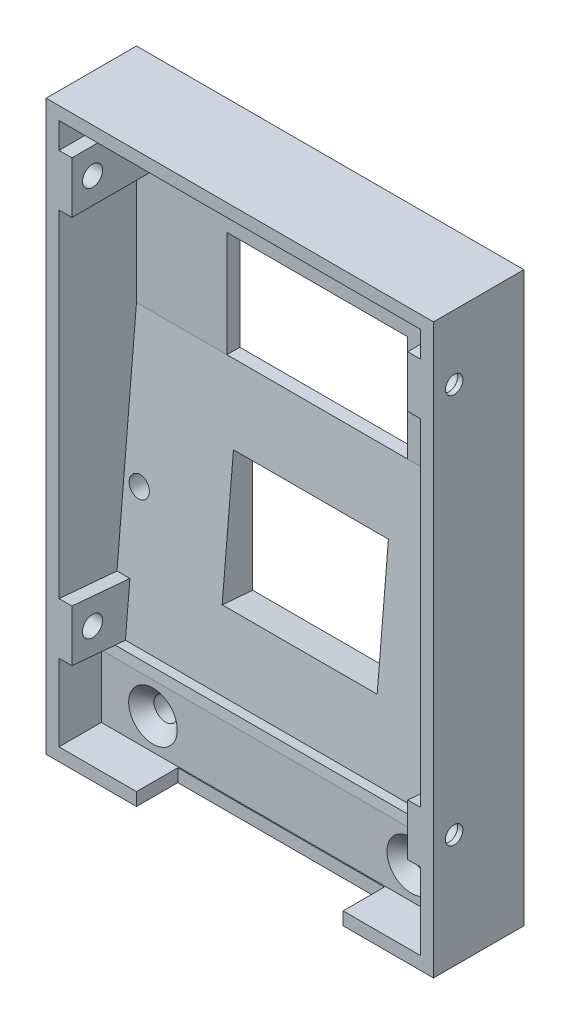
from build123d import *

# Parameters (mm, degrees)
SKICA1_W                                          = 75
SKICA1_H                                          = 110
SKICA1_W_2                                        = 35
SKICA1_H_2                                        = 70
P_IDAT_VYSUNUT_M1_DEPTH                           = 2.5
SKICA2_W                                          = 75
SKICA2_H                                          = 110
SKICA2_W_2                                        = 70
SKICA2_H_2                                        = 105
P_IDAT_VYSUNUT_M2_DEPTH                           = 15
P_IDAT_VYSUNUT_M3_REACH                           = 94.669
SKICA4_W                                          = 35
SKICA4_H                                          = 49.5
P_IDAT_VYSUNUT_M4_DEPTH                           = 2.5
SKICA5_W                                          = 70
SKICA5_H                                          = 2
P_IDAT_VYSUNUT_M5_DEPTH                           = 2
P_IDAT_VYSUNUT_M7_REACH                           = 94.669
KU_ELOV_ZAHLOUBEN_PRO_M4_ROUBU_SE_Z_P_D           = 4.5
KU_ELOV_ZAHLOUBEN_PRO_M4_ROUBU_SE_Z_P_CSINK_D     = 9.4
KU_ELOV_ZAHLOUBEN_PRO_M4_ROUBU_SE_Z_P_CSINK_ANGLE = 90
KU_ELOV_ZAHLOUBEN_PRO_M4_ROUBU_SE_2_A_COUNT       = 2
KU_ELOV_ZAHLOUBEN_PRO_M4_ROUBU_SE_2_A_PITCH       = 50
D_RY_PRO_KOL_K_VELIKOST_MM1_D                     = 3.9
D_RY_PRO_KOL_K_VELIKOST_MM1_DEPTH                 = 4
SKICA19_W                                         = 30
SKICA19_H                                         = 25
ODEBRAT_VYSUNUT_M1_DEPTH                          = 69.239931365
ODEBRAT_VYSUNUT_M4_DEPTH                          = 10
SKICA21_W                                         = 15
SKICA21_H                                         = 10
P_IDAT_VYSUNUT_M8_DEPTH                           = 2.5
V_LCOV_ZAHLOUBEN_PRO_M3_ROUBY_S_VNIT_D            = 3.4
V_LCOV_ZAHLOUBEN_PRO_M3_ROUBY_S_VNIT_DEPTH        = 5
V_LCOV_ZAHLOUBEN_PRO_M3_ROUBY_S_VNIT_CBORE_D      = 3.9
V_LCOV_ZAHLOUBEN_PRO_M3_ROUBY_S_VNIT_CBORE_DEPTH  = 4


with BuildPart() as part:
    # Skica1 → Přidat vysunutím1 (new body)
    with BuildSketch(Plane.XY):
        Rectangle(SKICA1_W, SKICA1_H)
        Rectangle(SKICA1_W_2, SKICA1_H_2, mode=Mode.SUBTRACT)
    extrude(amount=P_IDAT_VYSUNUT_M1_DEPTH)

    # Skica2 → Přidat vysunutím2 (add)
    with BuildSketch(Plane.XY.offset(2.5)):
        Rectangle(SKICA2_W, SKICA2_H)
        Rectangle(SKICA2_W_2, SKICA2_H_2, mode=Mode.SUBTRACT)
    extrude(amount=P_IDAT_VYSUNUT_M2_DEPTH)

    # Skica3 → Přidat vysunutím3 (add, up to next)
    with BuildSketch(Plane.ZY.offset(-35), mode=Mode.PRIVATE) as p_idat_vysunut_m3_sk1:
        Polygon((2.5, -52.5), (2.5, 14.5), (8.361740456, -52.5), align=None)
    p_idat_vysunut_m3_tool1 = extrude(p_idat_vysunut_m3_sk1.sketch, amount=P_IDAT_VYSUNUT_M3_REACH, mode=Mode.PRIVATE) - part.part
    add(p_idat_vysunut_m3_tool1.solids().sort_by_distance((35, -30.166667, 4.453913))[0])

    # Skica4 → Přidat vysunutím4 (add)
    with BuildSketch(Plane(origin=(0, 0, 2.5), x_dir=(-1, 0, 0), z_dir=(0, 0, -1))):
        with Locations((0, -10.25)):
            Rectangle(SKICA4_W, SKICA4_H)
    extrude(amount=P_IDAT_VYSUNUT_M4_DEPTH)

    # Skica5 → Přidat vysunutím5 (add)
    with BuildSketch(Plane(origin=(0, 0.327204013, 3.739958979), x_dir=(1, 0, 0), z_dir=(0, 0.08715574274765159, 0.9961946980917462))):
        with Locations((0, -40.02899535)):
            Rectangle(SKICA5_W, SKICA5_H)
    extrude(amount=P_IDAT_VYSUNUT_M5_DEPTH)

    # Skica9 → Přidat vysunutím7 (add, up to next)
    with BuildSketch(Plane.ZY.offset(-35), mode=Mode.PRIVATE) as p_idat_vysunut_m7_sk1:
        Polygon((9.308260939, -52.5), (9.308260939, -40.371352137), (7.315871543, -40.545663623), (8.361740456, -52.5), align=None)
    p_idat_vysunut_m7_tool1 = extrude(p_idat_vysunut_m7_sk1.sketch, amount=P_IDAT_VYSUNUT_M7_REACH, mode=Mode.PRIVATE) - part.part
    add(p_idat_vysunut_m7_tool1.solids().sort_by_distance((35, -45.761665, 8.543512))[0])

    # Ku_elov_ zahlouben_ pro M4 _roubu se z_p (through all)
    with Locations(Plane.XY.offset(9.308260939)):
        with Locations((25, -46.435676069), (-25, -46.435676069)):
            CounterSinkHole(KU_ELOV_ZAHLOUBEN_PRO_M4_ROUBU_SE_Z_P_D / 2, KU_ELOV_ZAHLOUBEN_PRO_M4_ROUBU_SE_Z_P_CSINK_D / 2, counter_sink_angle=KU_ELOV_ZAHLOUBEN_PRO_M4_ROUBU_SE_Z_P_CSINK_ANGLE)

    # Skica15 → Ku_elov_ zahlouben_ pro M4 _roubu se 2 (revolve, cut)
    with BuildSketch(Plane(origin=(25, 42.5, 2.5), x_dir=(0, -1, 0), z_dir=(1, 0, 0))):
        Polygon((0, 0), (0, 2.5), (2.25, 2.5), (2.25, 2.45), (4.7, 0), align=None)
    ku_elov_zahlouben_pro_m4_roubu_se_2 = revolve(axis=Axis((25, 42.5, 8.85), (0, 0, -1)), mode=Mode.SUBTRACT)

    # Ku_elov_ zahlouben_ pro M4 _roubu se 2 a: Ku_elov_ zahlouben_ pro M4 _roubu se 2 ×2
    with Locations(*[(-i * KU_ELOV_ZAHLOUBEN_PRO_M4_ROUBU_SE_2_A_PITCH, 0, 0) for i in range(1, KU_ELOV_ZAHLOUBEN_PRO_M4_ROUBU_SE_2_A_COUNT)]):
        add(ku_elov_zahlouben_pro_m4_roubu_se_2, mode=Mode.SUBTRACT)

    # Díry pro kolík, velikost mm1
    with Locations(Plane(origin=(0, 0.327204013, 3.739958979), x_dir=(1, 0, 0), z_dir=(0, 0.08715574274765159, 0.9961946980917462))):
        with Locations((32, -14.02899535), (-32, -14.02899535)):
            Hole(D_RY_PRO_KOL_K_VELIKOST_MM1_D / 2, depth=D_RY_PRO_KOL_K_VELIKOST_MM1_DEPTH)

    # Skica19 → Odebrat vysunutím1 (cut, through all)
    with BuildSketch(Plane(origin=(0, 0.327204013, 3.739958979), x_dir=(1, 0, 0), z_dir=(0, 0.08715574274765159, 0.9961946980917462))):
        with Locations((0, -12.401030792)):
            Rectangle(SKICA19_W, SKICA19_H)
    extrude(amount=-ODEBRAT_VYSUNUT_M1_DEPTH, mode=Mode.SUBTRACT)

    # Skica20 → Odebrat vysunutím4 (cut)
    with BuildSketch(Plane.XZ.offset(55)):
        Polygon((0, 9.5), (-20, 9.5), (-20, 17.5), (20, 17.5), (20, 9.5), align=None)
    extrude(amount=-ODEBRAT_VYSUNUT_M4_DEPTH, mode=Mode.SUBTRACT)

    # Skica21 → Přidat vysunutím8 (add)
    with BuildSketch(Plane(origin=(-35, 0, 0), x_dir=(0, 0, -1), z_dir=(1, 0, 0))):
        Polygon((-7.141560058, -38.553274227), (-6.273319169, -28.629235462), (-17.5, -27.64702816), (-17.5, -37.64702816), align=None)
        with Locations((-10, 42.5)):
            Rectangle(SKICA21_W, SKICA21_H)
    p_idat_vysunut_m8 = extrude(amount=P_IDAT_VYSUNUT_M8_DEPTH)

    # Zrcadlit1: Přidat vysunutím8 across plane
    add(p_idat_vysunut_m8.mirror(Plane(origin=(0, 0, 0), x_dir=(0, 0, 1), z_dir=(1, 0, 0))))

    # Válcové zahloubení pro M3 šrouby s vnitřním šestihranem1
    with Locations(Plane(origin=(-32.5, 0, 0), x_dir=(0, 0, -1), z_dir=(1, 0, 0))):
        with Locations((-13.5, 42.5), (-13.515221208, -32.995651131)):
            v_lcov_zahlouben_pro_m3_rouby_s_vnit = CounterBoreHole(V_LCOV_ZAHLOUBEN_PRO_M3_ROUBY_S_VNIT_D / 2, V_LCOV_ZAHLOUBEN_PRO_M3_ROUBY_S_VNIT_CBORE_D / 2, V_LCOV_ZAHLOUBEN_PRO_M3_ROUBY_S_VNIT_CBORE_DEPTH, depth=V_LCOV_ZAHLOUBEN_PRO_M3_ROUBY_S_VNIT_DEPTH)

    # Zrcadlit2: Válcové zahloubení pro M3 šrouby s vnitřním šestihranem1 across plane
    add(v_lcov_zahlouben_pro_m3_rouby_s_vnit.mirror(Plane(origin=(0, 0, 0), x_dir=(0, 0, 1), z_dir=(1, 0, 0))), mode=Mode.SUBTRACT)


solid = part.part
